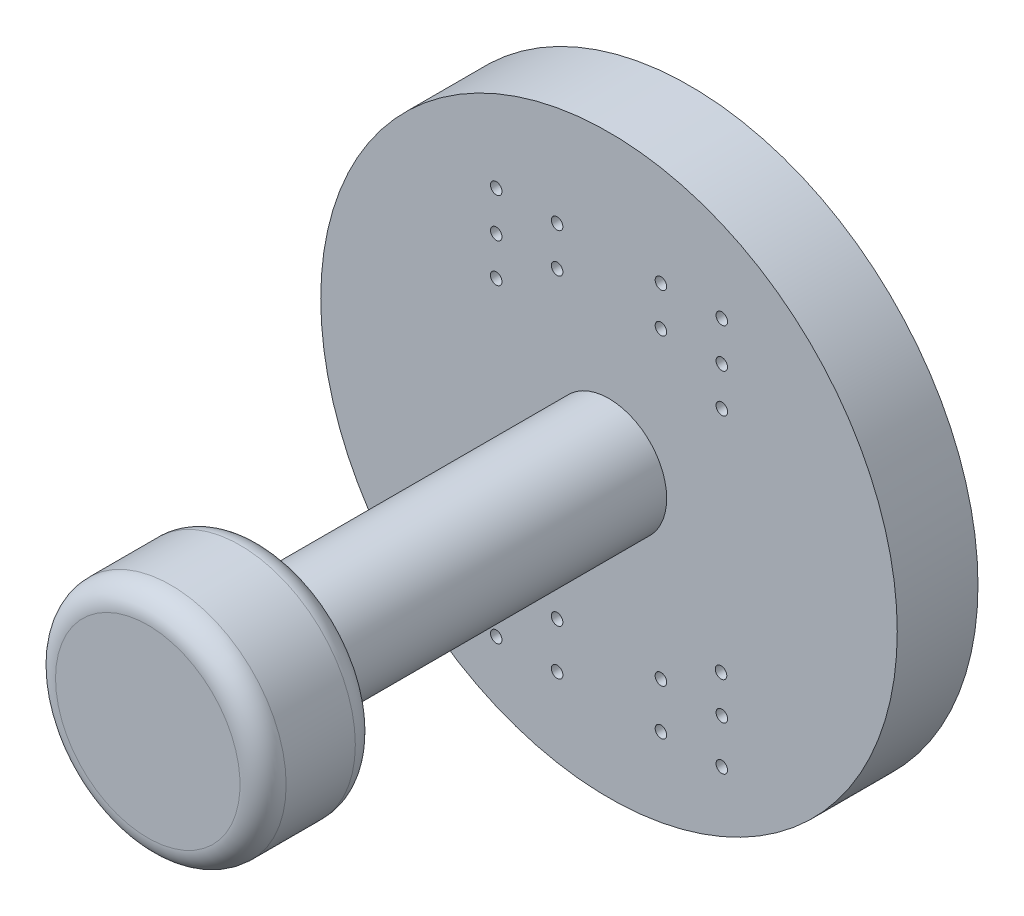
from build123d import *

# Parameters (mm, degrees)
SKETCH1_R           = 25
BOSS_EXTRUDE1_DEPTH = 5
SKETCH2_RX          = 2.1
SKETCH2_RY          = 1.5
SKETCH2_R           = 0.518128849
BOSS_EXTRUDE2_DEPTH = 2
SKETCH3_R           = 0.5
CUT_EXTRUDE1_DEPTH  = 36.707142143
BOSS_EXTRUDE4_START = 2
SKETCH4_R           = 25
SKETCH4_R_2         = 23.007381087
BOSS_EXTRUDE4_DEPTH = 2


with BuildPart() as part:
    # Sketch1 → Boss-Extrude1 (new body)
    with BuildSketch(Plane.XY):
        Circle(SKETCH1_R)
    extrude(amount=BOSS_EXTRUDE1_DEPTH)

    # Sketch2 → Boss-Extrude2 (add)
    # profile 1 of 5: a face of its own
    with BuildSketch(Plane(origin=(0, 0, 0), x_dir=(-1, 0, 0), z_dir=(0, 0, -1))):
        with BuildLine():
            Line((14.136829803, 0.416245401), (15.569591433, 8.79462198))
            ThreePointArc((15.569591433, 8.79462198), (18.762283071, 11.116793185), (14.997353799, 9.928909953))
            Line((14.997353799, 9.928909953), (9.08074084, 6.188095723))
            Line((9.08074084, 6.188095723), (9.08074084, 4.188095723))
            ThreePointArc((9.08074084, 4.188095723), (5.390688396, 8.422617088), (0, 10))
            ThreePointArc((0, 10), (-5.390688396, 8.422617088), (-9.08074084, 4.188095723))
            Line((-9.08074084, 4.188095723), (-9.08074084, 6.188095723))
            Line((-9.08074084, 6.188095723), (-14.997353799, 9.928909953))
            ThreePointArc((-14.997353799, 9.928909953), (-18.762283071, 11.116793185), (-15.569591433, 8.79462198))
            Line((-15.569591433, 8.79462198), (-14.136829803, 0.416245401))
            Line((-14.136829803, 0.416245401), (-11.971082941, -0.83257025))
            ThreePointArc((-11.971082941, -0.83257025), (0, -12), (11.971082941, -0.83257025))
            Line((11.971082941, -0.83257025), (14.136829803, 0.416245401))
        make_face()
        with BuildLine():
            Line((-0.758529186, 1.832589074), (-0.758529186, 2.393390515))
            ThreePointArc((-0.758529186, 2.393390515), (0, 6.13651388), (0.758529186, 2.393390515))
            Line((0.758529186, 2.393390515), (0.758529186, 1.832589074))
            Line((0.758529186, 1.832589074), (-0.758529186, 1.832589074))
        make_face(mode=Mode.SUBTRACT)
        with BuildLine():
            ThreePointArc((-6.236314399, 1.832589074), (0, -10.485460932), (6.236314399, 1.832589074))
            Line((6.236314399, 1.832589074), (0, 0))
            Line((0, 0), (-6.236314399, 1.832589074))
        make_face(mode=Mode.SUBTRACT)
    # profile 2 of 5: a face of its own
    with BuildSketch(Plane(origin=(0, 0, 0), x_dir=(-1, 0, 0), z_dir=(0, 0, -1))):
        with Locations(Location((-3.116282157, -3.288657736), (0, 0, -90))):
            Ellipse(SKETCH2_RX, SKETCH2_RY)
    # profile 3 of 5: a face of its own
    with BuildSketch(Plane(origin=(0, 0, 0), x_dir=(-1, 0, 0), z_dir=(0, 0, -1))):
        with Locations(Location((3.116282157, -3.288657736), (0, 0, -90))):
            Ellipse(SKETCH2_RX, SKETCH2_RY)
    # profile 4 of 5: a face of its own
    with BuildSketch(Plane(origin=(0, 0, 0), x_dir=(-1, 0, 0), z_dir=(0, 0, -1))):
        with Locations((0.878678891, 4.497077937)):
            Circle(SKETCH2_R)
    # profile 5 of 5: a face of its own
    with BuildSketch(Plane(origin=(0, 0, 0), x_dir=(-1, 0, 0), z_dir=(0, 0, -1))):
        with Locations(Location((-0.878678891, 4.497077937, 0), (0, 0, 180))):
            Circle(SKETCH2_R)
    extrude(amount=BOSS_EXTRUDE2_DEPTH)

    # Sketch3 → Cut-Extrude1 (cut, through all)
    with BuildSketch(Plane(origin=(0, 0, 0), x_dir=(-1, 0, 0), z_dir=(0, 0, -1))):
        with Locations((9.782386324, 12.497076735)):
            Circle(SKETCH3_R)
        with Locations((9.782386324, 15.910239984)):
            Circle(SKETCH3_R)
        with Locations((9.782386324, 9.13143185)):
            Circle(SKETCH3_R)
        with Locations((4.501388335, 12.497076735)):
            Circle(SKETCH3_R)
        with Locations((4.501388335, 15.910239984)):
            Circle(SKETCH3_R)
        with Locations((9.782386324, -17.768118771)):
            Circle(SKETCH3_R)
        with Locations((9.783740136, -13.926982269)):
            Circle(SKETCH3_R)
        with Locations((9.713673566, -10.704966648)):
            Circle(SKETCH3_R)
        with Locations((4.501388335, -17.768118771)):
            Circle(SKETCH3_R)
        with Locations((4.501388335, -13.810006537)):
            Circle(SKETCH3_R)
        with Locations((-4.501388335, 15.910239984)):
            Circle(SKETCH3_R)
        with Locations((-4.501388335, 12.497076735)):
            Circle(SKETCH3_R)
        with Locations((-9.782386324, 12.497076735)):
            Circle(SKETCH3_R)
        with Locations((-9.782386324, 15.910239984)):
            Circle(SKETCH3_R)
        with Locations((-9.782386324, 9.13143185)):
            Circle(SKETCH3_R)
        with Locations((-4.501388335, -17.768118771)):
            Circle(SKETCH3_R)
        with Locations((-4.501388335, -13.810006537)):
            Circle(SKETCH3_R)
        with Locations((-9.783740136, -13.926982269)):
            Circle(SKETCH3_R)
        with Locations((-9.713673566, -10.704966648)):
            Circle(SKETCH3_R)
        with Locations((-9.782386324, -17.768118771)):
            Circle(SKETCH3_R)
    extrude(amount=-CUT_EXTRUDE1_DEPTH, mode=Mode.SUBTRACT)

    # Sketch4 → Boss-Extrude4 (add)
    with BuildSketch(Plane(origin=(0, 0, 0), x_dir=(-1, 0, 0), z_dir=(0, 0, -1)).offset(BOSS_EXTRUDE4_START)):
        Circle(SKETCH4_R)
        Circle(SKETCH4_R_2, mode=Mode.SUBTRACT)
    extrude(amount=-BOSS_EXTRUDE4_DEPTH)

    # Sketch5 → Revolve1 (revolve)
    with BuildSketch(Plane(origin=(0, 0, 0), x_dir=(0, 0, -1), z_dir=(1, 0, 0)), mode=Mode.PRIVATE) as revolve1_sk:
        with BuildLine():
            Line((-5, 5), (-35, 5))
            Line((-35, 5), (-35, 8))
            ThreePointArc((-35, 8), (-35.585786438, 9.414213562), (-37, 10))
            Line((-37, 10), (-43, 10))
            ThreePointArc((-43, 10), (-44.414213562, 9.414213562), (-45, 8))
            Line((-45, 8), (-45, 0))
            Line((-45, 0), (-5, 0))
            Line((-5, 0), (-5, 5))
        make_face()
    revolve(revolve1_sk.sketch.rotate(Axis((0, 0, 0), (0, 0, 1)), 90), axis=Axis((0, 0, 0), (0, 0, 1)))


solid = part.part
